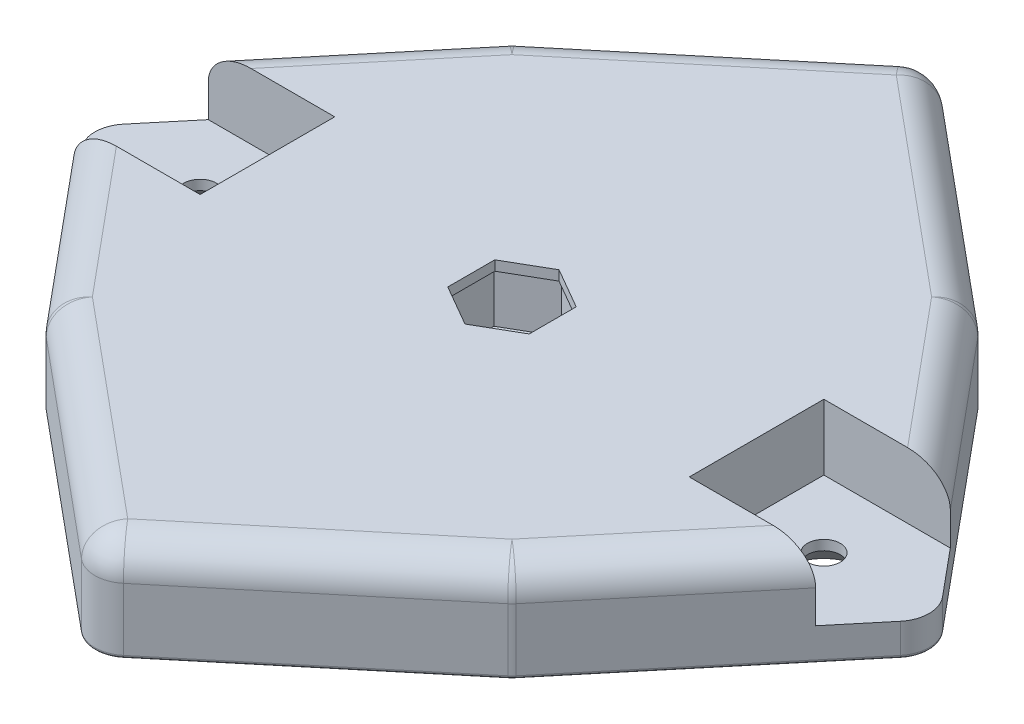
from build123d import *

# Parameters (mm, degrees)
ESQUISSE1_R             = 4.5
ESQUISSE1_R_2           = 2.5
BOSS_EXTRU_1_DEPTH      = 15
ESQUISSE2_OUTSIDE_W     = 172.858
ESQUISSE2_OUTSIDE_H     = 199.18
ENL_V_MAT_EXTRU_1_DEPTH = 103.80323738
CONG_1_R                = 5
ENL_V_MAT_EXTRU_2_DEPTH = 9
ESQUISSE3_W             = 26.279593634
ESQUISSE3_H             = 20.5
ENL_V_MAT_EXTRU_3_DEPTH = 10
CONG_2_R                = 5
CONG_3_R                = 0.5
ESQUISSE5_R             = 7.505553499
BOSS_EXTRU_2_DEPTH      = 1.5
CHANFREIN1_SIZE         = 3.5


with BuildPart() as part:
    # Esquisse1 → Boss.-Extru.1 (new body)
    with BuildSketch(Plane(origin=(0, 0, 0), x_dir=(1, 0, 0), z_dir=(0, 1, 0))):
        Polygon((-65.032881815, 0), (0, -78.193541284), (65.032881815, 0), (0, 78.193541284), align=None)
        with Locations(Location((0, 0, 0), (0, 0, 270))):
            Circle(ESQUISSE1_R, mode=Mode.SUBTRACT)
        with Locations(Location((-47.5, 0, 0), (0, 0, 270))):
            Circle(ESQUISSE1_R_2, mode=Mode.SUBTRACT)
        with Locations(Location((47.5, 0, 0), (0, 0, 270))):
            Circle(ESQUISSE1_R_2, mode=Mode.SUBTRACT)
    extrude(amount=BOSS_EXTRU_1_DEPTH)

    # Esquisse2 outside → Enlèv. mat.-Extru.1 (cut, through all)
    with BuildSketch(Plane(origin=(0, 15, 0), x_dir=(1, 0, 0), z_dir=(0, 1, 0))):
        Rectangle(ESQUISSE2_OUTSIDE_W, ESQUISSE2_OUTSIDE_H)
        Polygon((0, 65.032881815), (-78.193541284, 0), (0, -65.032881815), (78.193541284, 0), align=None, mode=Mode.SUBTRACT)
    extrude(amount=-ENL_V_MAT_EXTRU_1_DEPTH, mode=Mode.SUBTRACT)

    # Congé1
    cong_1_edges = [part.edges().sort_by_distance(p)[0] for p in [
        (35.504282094, 7.5, -35.504282094),
        (35.504282094, 7.5, 35.504282094),
        (-35.504282094, 7.5, 35.504282094),
        (-35.504282094, 7.5, -35.504282094),
        (0, 7.5, -65.032881815),
        (0, 7.5, 65.032881815),
        (65.032881815, 7.5, 0),
        (-65.032881815, 7.5, 0),
    ]]
    fillet(cong_1_edges, radius=CONG_1_R)

    # Esquisse4 → Enlèv. mat.-Extru.2 (cut)
    with BuildSketch(Plane(origin=(0, 15, 0), x_dir=(1, 0, 0), z_dir=(0, 1, 0))):
        Polygon((6.5, 3.75277675), (0, 7.505553499), (-6.5, 3.75277675), (-6.5, -3.75277675), (0, -7.505553499), (6.5, -3.75277675), align=None)
    extrude(amount=-ENL_V_MAT_EXTRU_2_DEPTH, mode=Mode.SUBTRACT)

    # Esquisse3 → Enlèv. mat.-Extru.3 (cut)
    with BuildSketch(Plane(origin=(0, 15, 0), x_dir=(1, 0, 0), z_dir=(0, 1, 0))):
        with Locations((-50.389796817, 0)):
            Rectangle(ESQUISSE3_W, ESQUISSE3_H)
        with Locations((50.389796817, 0)):
            Rectangle(ESQUISSE3_W, ESQUISSE3_H)
    extrude(amount=-ENL_V_MAT_EXTRU_3_DEPTH, mode=Mode.SUBTRACT)

    # Congé2
    cong_2_edges = [part.edges().sort_by_distance(p)[0] for p in [
        (46.153054923, 15, -22.700524447),
        (-46.153054923, 15, 22.700524447),
        (-19.174121952, 15, -49.08593292),
        (19.174121952, 15, 49.08593292),
        (46.153054923, 15, 22.700524447),
        (19.174121952, 15, -49.08593292),
        (-46.153054923, 15, -22.700524447),
        (-19.174121952, 15, 49.08593292),
        (0, 15, -63.529593634),
        (0, 15, 63.529593634),
        (-35.489387791, 15, 35.489387791),
        (35.489387791, 15, 35.489387791),
        (35.489387791, 15, -35.489387791),
        (-35.489387791, 15, -35.489387791),
    ]]
    fillet(cong_2_edges, radius=CONG_2_R)

    # Congé3
    cong_3_edges = [part.edges().sort_by_distance(p)[0] for p in [
        (-19.174121952, 0, -49.08593292),
        (-49.08593292, 0, -19.174121952),
        (49.08593292, 0, 19.174121952),
        (19.174121952, 0, 49.08593292),
        (-19.174121952, 0, 49.08593292),
        (-49.08593292, 0, 19.174121952),
        (19.174121952, 0, -49.08593292),
        (49.08593292, 0, -19.174121952),
        (-63.529593634, 0, 0),
        (63.529593634, 0, 0),
        (0, 0, -63.529593634),
        (0, 0, 63.529593634),
        (-35.489387791, 0, 35.489387791),
        (35.489387791, 0, 35.489387791),
        (35.489387791, 0, -35.489387791),
        (-35.489387791, 0, -35.489387791),
    ]]
    fillet(cong_3_edges, radius=CONG_3_R)

    # Esquisse5 → Boss.-Extru.2 (add)
    with BuildSketch(Plane(origin=(0, 15, 0), x_dir=(1, 0, 0), z_dir=(0, 1, 0))):
        Circle(ESQUISSE5_R)
        Polygon((6.2, 3.579571669), (0, 7.159143338), (-6.2, 3.579571669), (-6.2, -3.579571669), (0, -7.159143338), (6.2, -3.579571669), align=None, mode=Mode.SUBTRACT)
    extrude(amount=-BOSS_EXTRU_2_DEPTH)

    # Chanfrein1
    chanfrein1_edges = [part.edges().sort_by_distance(p)[0] for p in [
        (-47.5, 0, -2.5),
        (47.5, 0, -2.5),
    ]]
    chamfer(chanfrein1_edges, length=CHANFREIN1_SIZE)


solid = part.part
